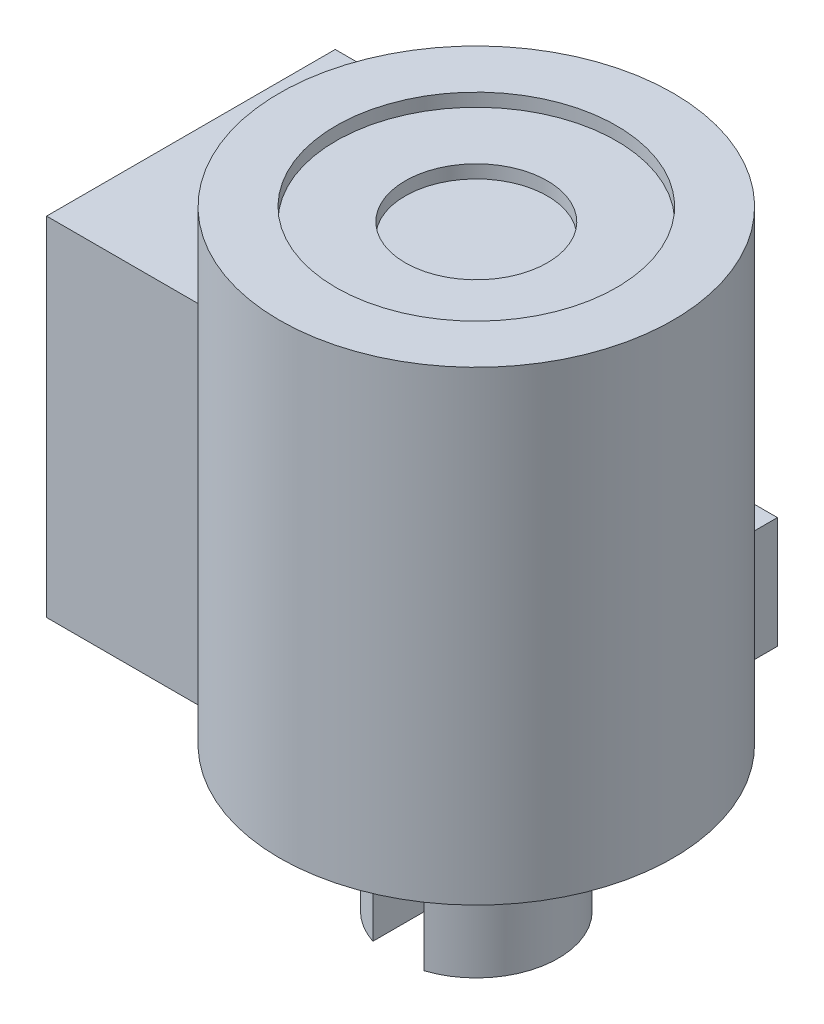
from build123d import *

# Parameters (mm, degrees)
ESBO_O1_R                     = 30
RESSALTO_EXTRUS_O2_DEPTH      = 10
ESBO_O3_R                     = 12.494753049
RESSALTO_EXTRUS_O3_DEPTH      = 22
ESBO_O4_R                     = 30
ESBO_O4_R_2                   = 18.335840205
RESSALTO_EXTRUS_O4_DEPTH      = 51
ESBO_O5_R                     = 30
RESSALTO_EXTRUS_O5_DEPTH      = 10
ESBO_O6_R                     = 21.382326649
CORTE_EXTRUS_O1_DEPTH         = 2
ESBO_O7_R                     = 10.833594829
CORTE_EXTRUS_O2_DEPTH         = 2
ESBO_O8_W                     = 7.784469092
ESBO_O8_H                     = 33.042586886
CORTE_EXTRUS_O3_DEPTH         = 17
RESSALTO_EXTRUS_O7_DEPTH      = 17
ESBO_O11_W                    = 17.91144748
ESBO_O11_H                    = 4.730260337
CORTE_EXTRUS_O4_DEPTH         = 14
RESSALTO_EXTRUS_O9_DEPTH      = 29
RESSALTO_EXTRUS_O9_DEPTH_BACK = 24


with BuildPart() as part:
    # Esboço1 → Ressalto-extrusão2 (new body)
    with BuildSketch(Plane(origin=(0, 0, 0), x_dir=(1, 0, 0), z_dir=(0, 1, 0))):
        with Locations(Location((0, 0, 0), (0, 0, 270))):
            Circle(ESBO_O1_R)
    extrude(amount=RESSALTO_EXTRUS_O2_DEPTH)

    # Esboço3 → Ressalto-extrusão3 (add)
    with BuildSketch(Plane.XZ):
        with Locations(Location((0, 0, 0), (0, 0, 270))):
            Circle(ESBO_O3_R)
    extrude(amount=RESSALTO_EXTRUS_O3_DEPTH)

    # Esboço4 → Ressalto-extrusão4 (add)
    with BuildSketch(Plane(origin=(0, 10, 0), x_dir=(1, 0, 0), z_dir=(0, 1, 0))):
        with Locations(Location((0, 0, 0), (0, 0, 270))):
            Circle(ESBO_O4_R)
        with Locations(Location((0, 0, 0), (0, 0, 90))):
            Circle(ESBO_O4_R_2, mode=Mode.SUBTRACT)
    extrude(amount=RESSALTO_EXTRUS_O4_DEPTH)

    # Esboço5 → Ressalto-extrusão5 (add)
    with BuildSketch(Plane(origin=(0, 61, 0), x_dir=(1, 0, 0), z_dir=(0, 1, 0))):
        with Locations(Location((0, 0, 0), (0, 0, 270))):
            Circle(ESBO_O5_R)
    extrude(amount=RESSALTO_EXTRUS_O5_DEPTH)

    # Esboço6 → Corte-extrusão1 (cut)
    with BuildSketch(Plane(origin=(0, 71, 0), x_dir=(1, 0, 0), z_dir=(0, 1, 0))):
        with Locations(Location((0, 0, 0), (0, 0, 270))):
            Circle(ESBO_O6_R)
    extrude(amount=-CORTE_EXTRUS_O1_DEPTH, mode=Mode.SUBTRACT)

    # Esboço7 → Corte-extrusão2 (cut)
    with BuildSketch(Plane(origin=(0, 69, 0), x_dir=(1, 0, 0), z_dir=(0, 1, 0))):
        with Locations(Location((0, 0, 0), (0, 0, 270))):
            Circle(ESBO_O7_R)
    extrude(amount=-CORTE_EXTRUS_O2_DEPTH, mode=Mode.SUBTRACT)

    # Esboço8 → Corte-extrusão3 (cut)
    with BuildSketch(Plane.XZ.offset(22)):
        Rectangle(ESBO_O8_W, ESBO_O8_H)
    extrude(amount=-CORTE_EXTRUS_O3_DEPTH, mode=Mode.SUBTRACT)

    # Esboço10 → Ressalto-extrusão7 (add)
    with BuildSketch(Plane.XZ):
        with BuildLine():
            Line((-10, -30), (-10, -35.901739495))
            Line((-10, -35.901739495), (10, -35.901739495))
            Line((10, -35.901739495), (10, -30))
            Line((10, -30), (10, -28.284271247))
            ThreePointArc((10, -28.284271247), (0, -30), (-10, -28.284271247))
            Line((-10, -28.284271247), (-10, -30))
        make_face()
    extrude(amount=-RESSALTO_EXTRUS_O7_DEPTH)

    # Esboço11 → Corte-extrusão4 (cut)
    with BuildSketch(Plane.XZ):
        with Locations((-0.221595313, -32.668697771)):
            Rectangle(ESBO_O11_W, ESBO_O11_H)
    extrude(amount=-CORTE_EXTRUS_O4_DEPTH, mode=Mode.SUBTRACT)

    # Esboço13 → Ressalto-extrusão9 (add, two sides: drawn at the far end of the back side and taken through both)
    with BuildSketch(Plane(origin=(0, 30, 0), x_dir=(1, 0, 0), z_dir=(0, 1, 0)).offset(-RESSALTO_EXTRUS_O9_DEPTH_BACK)):
        with BuildLine():
            Line((-30, 22), (-43.507715599, 22))
            Line((-43.507715599, 22), (-43.507715599, -22))
            Line((-43.507715599, -22), (-30, -22))
            Line((-30, -22), (-20.396078054, -22))
            ThreePointArc((-20.396078054, -22), (30, 0), (-20.396078054, 22))
            Line((-20.396078054, 22), (-30, 22))
        make_face()
    extrude(amount=RESSALTO_EXTRUS_O9_DEPTH + RESSALTO_EXTRUS_O9_DEPTH_BACK)


solid = part.part
